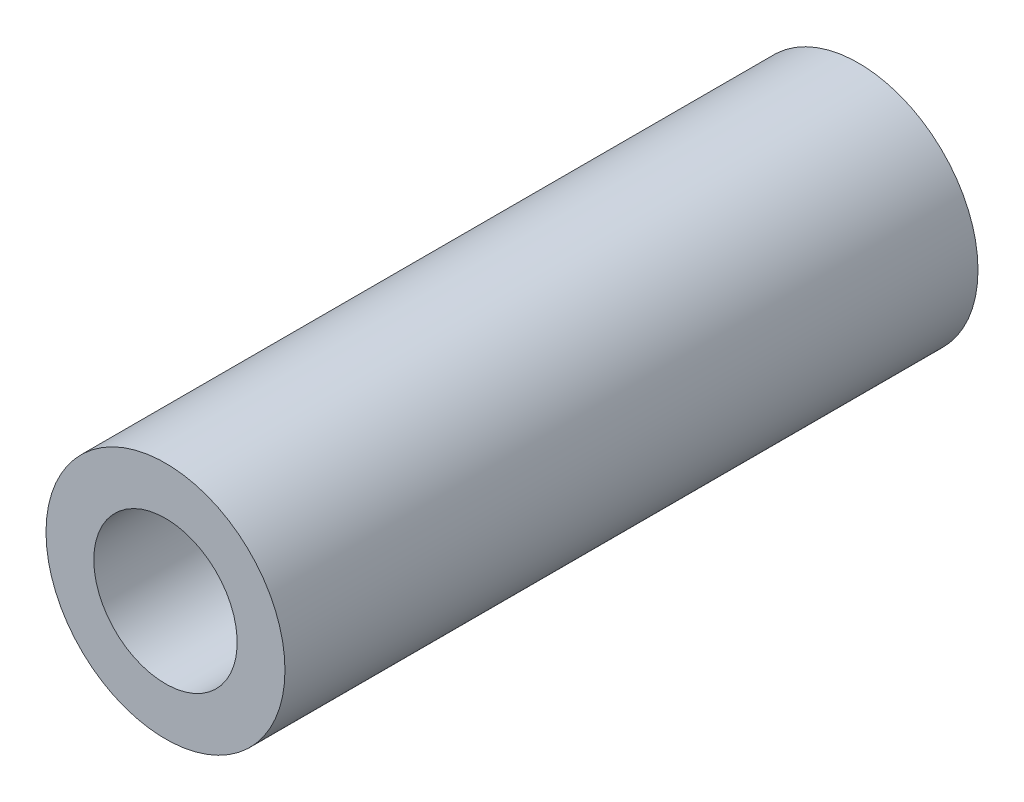
from build123d import *

# Parameters (mm, degrees)
SKETCH_1_R      = 5
SKETCH_1_R_2    = 3
EXTRUDE_1_DEPTH = 29


with BuildPart() as part:
    # 草图1 → 凸台-拉伸1 (new body)
    with BuildSketch(Plane.XY):
        with Locations(Location((0, 0, 0), (0, 0, 180))):
            Circle(SKETCH_1_R)
        with Locations(Location((0, 0, 0), (0, 0, 180))):
            Circle(SKETCH_1_R_2, mode=Mode.SUBTRACT)
    extrude(amount=EXTRUDE_1_DEPTH)


solid = part.part
